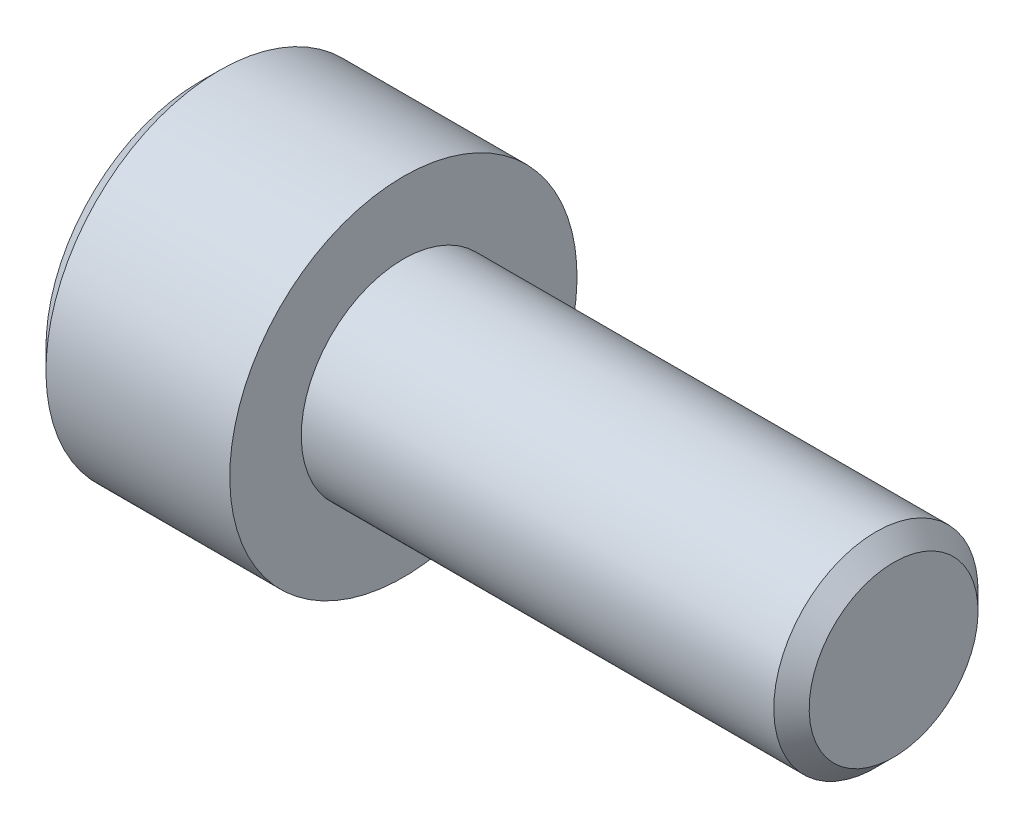
from build123d import *

# Parameters (mm, degrees)
CUT_EXTRUDE1_DEPTH = 2.5


with BuildPart() as part:
    # Sketch1 → Revolve1 (revolve)
    with BuildSketch(Plane.XY):
        Polygon((0, 2.5), (0, 4.25), (-4.5, 4.25), (-5, 3.75), (-5, 0), (12, 0), (12, 2.067), (11.567, 2.5), align=None)
    revolve(axis=Axis((12, 0, 0), (-1, 0, 0)))

    # Sketch2 → Cut-Extrude1 (cut)
    with BuildSketch(Plane.ZY.offset(5)):
        Polygon((0, 2.309401077), (-2, 1.154700538), (-2, -1.154700538), (0, -2.309401077), (2, -1.154700538), (2, 1.154700538), align=None)
    extrude(amount=-CUT_EXTRUDE1_DEPTH, mode=Mode.SUBTRACT)


solid = part.part
